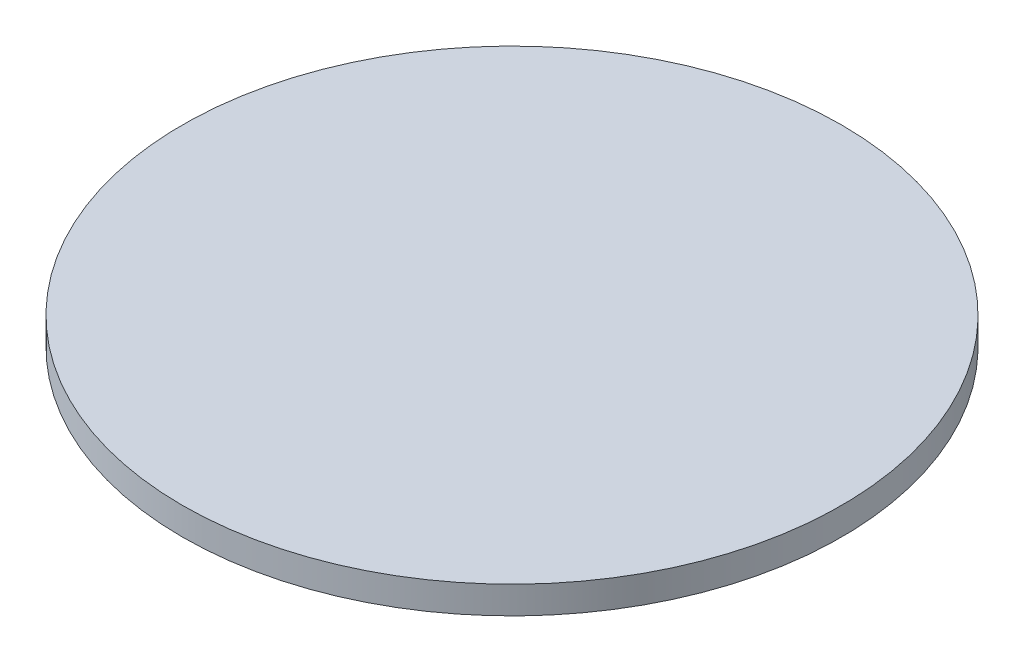
from build123d import *

# Parameters (mm, degrees)
SKETCH1_R           = 12000
BOSS_EXTRUDE1_DEPTH = 1000


with BuildPart() as part:
    # Sketch1 → Boss-Extrude1 (new body)
    with BuildSketch(Plane(origin=(0, 0, 0), x_dir=(1, 0, 0), z_dir=(0, 1, 0))):
        with Locations(Location((0, 0, 0), (0, 0, 270))):
            Circle(SKETCH1_R)
    extrude(amount=BOSS_EXTRUDE1_DEPTH)


solid = part.part
